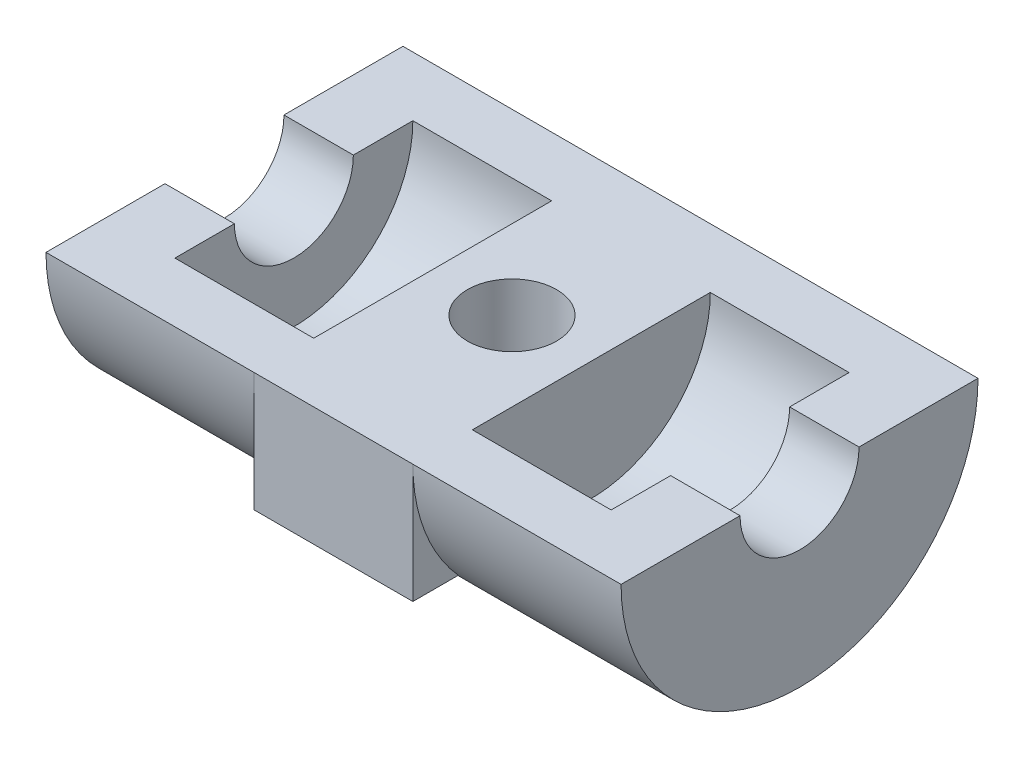
from build123d import *

# Parameters (mm, degrees)
CUT_EXTRUDE1_DEPTH      = 10
CUT_EXTRUDE1_DEPTH_BACK = 10
SKETCH4_R               = 2.25
SKETCH4_3_W             = 8
SKETCH4_3_H             = 18
SKETCH4_3_R             = 2.25
BOSS_EXTRUDE1_DEPTH     = 6
CUT_EXTRUDE2_DEPTH      = 32.670175393
CUT_EXTRUDE2_DEPTH_BACK = 32.670175393


with BuildPart() as part:
    # Sketch1 → Revolve1 (revolve)
    with BuildSketch(Plane.XY):
        Polygon((-14.5, 9), (14.5, 9), (14.5, 3), (11, 3), (11, 6), (-11, 6), (-11, 3), (-14.5, 3), align=None)
    revolve(axis=Axis((-39.087837838, 0, 0), (1, 0, 0)))

    # Sketch4 → Cut-Extrude1 (cut, two sides: drawn at the far end of the back side and taken through both)
    with BuildSketch(Plane(origin=(0, 0, 0), x_dir=(1, 0, 0), z_dir=(0, 1, 0)).offset(-CUT_EXTRUDE1_DEPTH_BACK)):
        Circle(SKETCH4_R)
    extrude(amount=CUT_EXTRUDE1_DEPTH + CUT_EXTRUDE1_DEPTH_BACK, mode=Mode.SUBTRACT)

    # Sketch4<3> → Boss-Extrude1 (add, symmetric)
    with BuildSketch(Plane(origin=(0, 0, 0), x_dir=(1, 0, 0), z_dir=(0, 1, 0))):
        Rectangle(SKETCH4_3_W, SKETCH4_3_H)
        Circle(SKETCH4_3_R, mode=Mode.SUBTRACT)
    extrude(amount=BOSS_EXTRUDE1_DEPTH, both=True)

    # Sketch5 → Cut-Extrude2 (cut, two sides: drawn at the far end of the back side and taken through both)
    with BuildSketch(Plane.ZY.offset(14.5).offset(-CUT_EXTRUDE2_DEPTH_BACK)):
        Polygon((-61.985560784, 0), (-9.284472497, 0), (10.360933076, 0), (63.062021364, 0), (63.062021364, 105.402176576), (-61.985560784, 105.402176576), align=None)
    extrude(amount=CUT_EXTRUDE2_DEPTH + CUT_EXTRUDE2_DEPTH_BACK, mode=Mode.SUBTRACT)


solid = part.part
